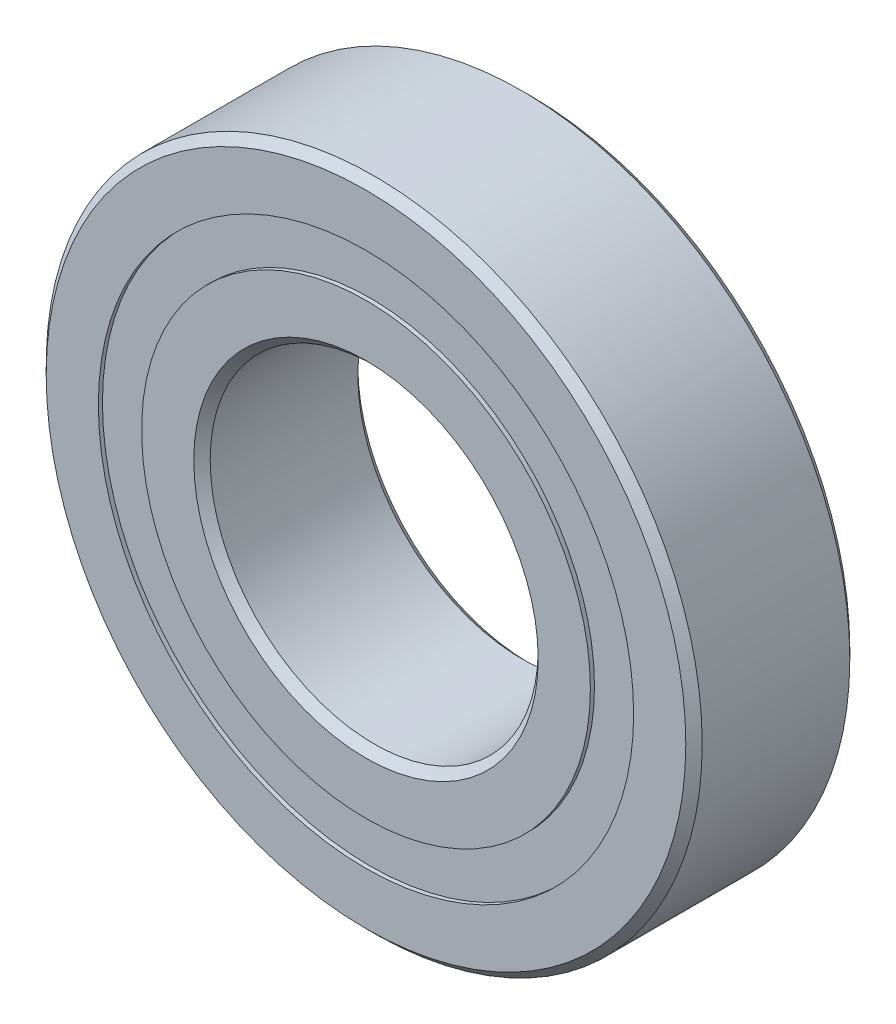
from build123d import *

# Parameters (mm, degrees)
CIRPATTERN1_COUNT = 12
SKETCH5_W         = 2.750786573
SKETCH5_H         = 3.34945055


with BuildPart() as part:
    # Sketch1 → Revolve1 (revolve)
    with BuildSketch(Plane(origin=(0, 0, 0), x_dir=(0, 0, -1), z_dir=(1, 0, 0)), mode=Mode.PRIVATE) as revolve1_sk:
        with BuildLine():
            Line((5.715, 25.4), (-5.715, 25.4))
            Line((-5.715, 25.4), (-6.35, 24.765))
            Line((-6.35, 24.765), (-6.35, 20.724725275))
            Line((-6.35, 20.724725275), (-2.822222222, 20.724725275))
            ThreePointArc((-2.822222222, 20.724725275), (0, 22.331713427), (2.822222222, 20.724725275))
            Line((2.822222222, 20.724725275), (6.35, 20.724725275))
            Line((6.35, 20.724725275), (6.35, 24.765))
            Line((6.35, 24.765), (5.715, 25.4))
        make_face()
    revolve(revolve1_sk.sketch.rotate(Axis((0, 0, 6.35), (0, 0, -1)), 90), axis=Axis((0, 0, 6.35), (0, 0, -1)))


with BuildPart() as body_2:
    # Sketch3 → Revolve3 (revolve)
    with BuildSketch(Plane(origin=(0, 0, 0), x_dir=(0, 0, -1), z_dir=(1, 0, 0)), mode=Mode.PRIVATE) as revolve3_sk:
        with BuildLine():
            Line((-6.35, 17.375274725), (-2.822222222, 17.375274725))
            ThreePointArc((-2.822222222, 17.375274725), (0, 15.768286573), (2.822222222, 17.375274725))
            Line((2.822222222, 17.375274725), (6.35, 17.375274725))
            Line((6.35, 17.375274725), (6.35, 13.335))
            Line((6.35, 13.335), (5.715, 12.7))
            Line((5.715, 12.7), (-5.715, 12.7))
            Line((-5.715, 12.7), (-6.35, 13.335))
            Line((-6.35, 13.335), (-6.35, 17.375274725))
        make_face()
    revolve(revolve3_sk.sketch.rotate(Axis((0, 0, 6.35), (0, 0, -1)), 90), axis=Axis((0, 0, 6.35), (0, 0, -1)))


with BuildPart() as body_3:
    # Sketch4 → Revolve4 (revolve)
    with BuildSketch(Plane(origin=(0, 0, 0), x_dir=(0, 0, -1), z_dir=(1, 0, 0))):
        with BuildLine():
            Line((-3.281713427, 19.05), (3.281713427, 19.05))
            ThreePointArc((3.281713427, 19.05), (0, 22.331713427), (-3.281713427, 19.05))
        make_face()
    revolve(axis=Axis((0, 19.05, 3.281713427), (0, 0, -1)))


with BuildPart() as cirpattern1_1:
    # CirPattern1: pattern copy
    add(body_3.part.rotate(Axis((0, 0, 0), (0, 0, 1)), 1 * 360 / CIRPATTERN1_COUNT))


with BuildPart() as cirpattern1_2:
    # CirPattern1: pattern copy
    add(body_3.part.rotate(Axis((0, 0, 0), (0, 0, 1)), 2 * 360 / CIRPATTERN1_COUNT))


with BuildPart() as cirpattern1_3:
    # CirPattern1: pattern copy
    add(body_3.part.rotate(Axis((0, 0, 0), (0, 0, 1)), 3 * 360 / CIRPATTERN1_COUNT))


with BuildPart() as cirpattern1_4:
    # CirPattern1: pattern copy
    add(body_3.part.rotate(Axis((0, 0, 0), (0, 0, 1)), 4 * 360 / CIRPATTERN1_COUNT))


with BuildPart() as cirpattern1_5:
    # CirPattern1: pattern copy
    add(body_3.part.rotate(Axis((0, 0, 0), (0, 0, 1)), 5 * 360 / CIRPATTERN1_COUNT))


with BuildPart() as cirpattern1_6:
    # CirPattern1: pattern copy
    add(body_3.part.rotate(Axis((0, 0, 0), (0, 0, 1)), 6 * 360 / CIRPATTERN1_COUNT))


with BuildPart() as cirpattern1_7:
    # CirPattern1: pattern copy
    add(body_3.part.rotate(Axis((0, 0, 0), (0, 0, 1)), 7 * 360 / CIRPATTERN1_COUNT))


with BuildPart() as cirpattern1_8:
    # CirPattern1: pattern copy
    add(body_3.part.rotate(Axis((0, 0, 0), (0, 0, 1)), 8 * 360 / CIRPATTERN1_COUNT))


with BuildPart() as cirpattern1_9:
    # CirPattern1: pattern copy
    add(body_3.part.rotate(Axis((0, 0, 0), (0, 0, 1)), 9 * 360 / CIRPATTERN1_COUNT))


with BuildPart() as cirpattern1_10:
    # CirPattern1: pattern copy
    add(body_3.part.rotate(Axis((0, 0, 0), (0, 0, 1)), 10 * 360 / CIRPATTERN1_COUNT))


with BuildPart() as cirpattern1_11:
    # CirPattern1: pattern copy
    add(body_3.part.rotate(Axis((0, 0, 0), (0, 0, 1)), 11 * 360 / CIRPATTERN1_COUNT))


with BuildPart() as body_15:
    # Sketch5 → Revolve5 (revolve)
    with BuildSketch(Plane(origin=(0, 0, 0), x_dir=(0, 0, -1), z_dir=(1, 0, 0)), mode=Mode.PRIVATE) as revolve5_sk:
        with Locations((-4.657106714, 19.05)):
            Rectangle(SKETCH5_W, SKETCH5_H)
        with Locations((4.657106714, 19.05)):
            Rectangle(SKETCH5_W, SKETCH5_H)
    revolve(revolve5_sk.sketch.rotate(Axis((0, 0, 6.35), (0, 0, -1)), 90), axis=Axis((0, 0, 6.35), (0, 0, -1)))


solid = Compound([part.part, body_2.part, body_3.part, cirpattern1_1.part, cirpattern1_2.part, cirpattern1_3.part, cirpattern1_4.part, cirpattern1_5.part, cirpattern1_6.part, cirpattern1_7.part, cirpattern1_8.part, cirpattern1_9.part, cirpattern1_10.part, cirpattern1_11.part, body_15.part])
